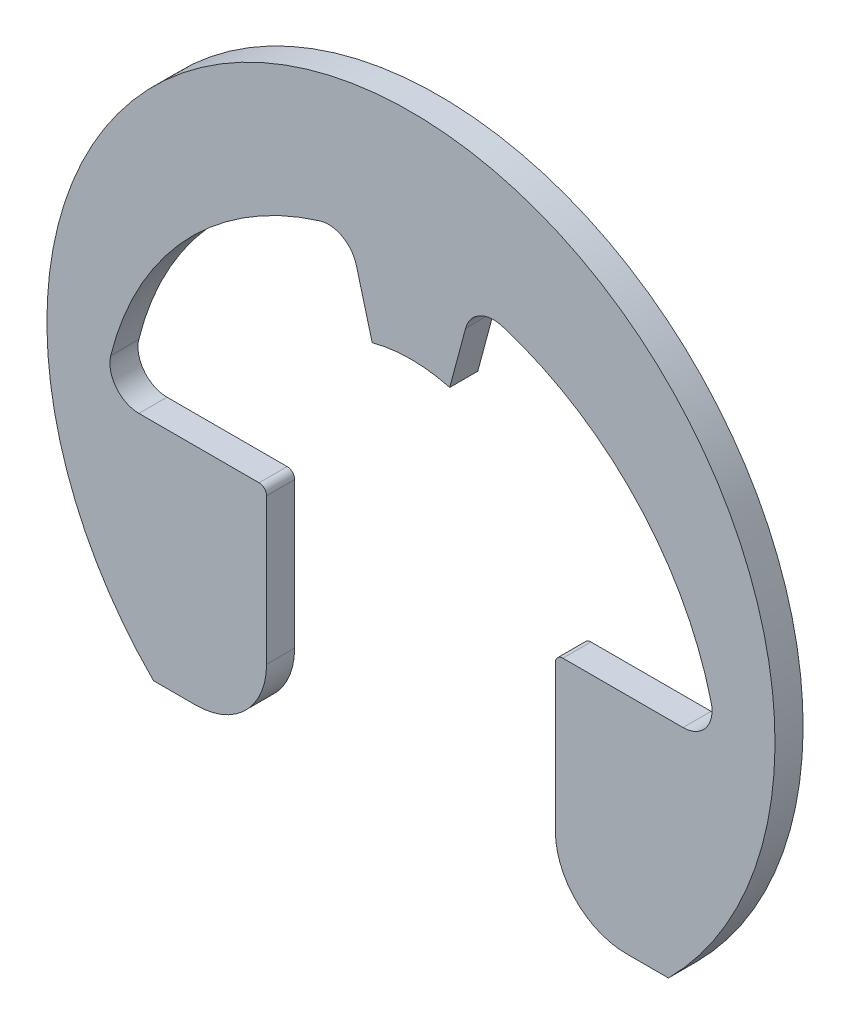
from build123d import *

# Parameters (mm, degrees)
BODY_DEPTH = 0.6


with BuildPart() as part:
    # BodySke → Body (new body)
    with BuildSketch(Plane.XY):
        with BuildLine():
            Line((5.500485921, -5.500485921), (4.596535167, -5.500485921))
            ThreePointArc((4.596535167, -5.500485921), (3.528079574, -5.057917123), (3.085510776, -3.98946153))
            Line((3.085510776, -3.98946153), (3.085510776, -0.869631992))
            ThreePointArc((3.085510776, -0.869631992), (3.132373691, -0.756494907), (3.245510776, -0.709631992))
            Line((3.245510776, -0.709631992), (5.812587034, -0.709631992))
            ThreePointArc((5.812587034, -0.709631992), (6.300881202, -0.471705822), (6.414422496, 0.059470637))
            ThreePointArc((6.414422496, 0.059470637), (4.802717732, 3.00966483), (1.948113616, 4.78518542))
            ThreePointArc((1.948113616, 4.78518542), (1.465426047, 4.735382034), (1.166433595, 4.353189439))
            Line((1.166433595, 4.353189439), (0.828220944, 3.090962644))
            ThreePointArc((0.828220944, 3.090962644), (0, 3.2), (-0.828220944, 3.090962644))
            Line((-0.828220944, 3.090962644), (-1.166433595, 4.353189439))
            ThreePointArc((-1.166433595, 4.353189439), (-1.465426047, 4.735382034), (-1.948113616, 4.78518542))
            ThreePointArc((-1.948113616, 4.78518542), (-4.802717732, 3.00966483), (-6.414422496, 0.059470637))
            ThreePointArc((-6.414422496, 0.059470637), (-6.300881202, -0.471705822), (-5.812587034, -0.709631992))
            Line((-5.812587034, -0.709631992), (-3.245510776, -0.709631992))
            ThreePointArc((-3.245510776, -0.709631992), (-3.132373691, -0.756494907), (-3.085510776, -0.869631992))
            Line((-3.085510776, -0.869631992), (-3.085510776, -3.98946153))
            ThreePointArc((-3.085510776, -3.98946153), (-3.528079574, -5.057917123), (-4.596535167, -5.500485921))
            Line((-4.596535167, -5.500485921), (-5.500485921, -5.500485921))
            ThreePointArc((-5.500485921, -5.500485921), (0, 7.778861789), (5.500485921, -5.500485921))
        make_face()
    extrude(amount=-BODY_DEPTH)


solid = part.part
